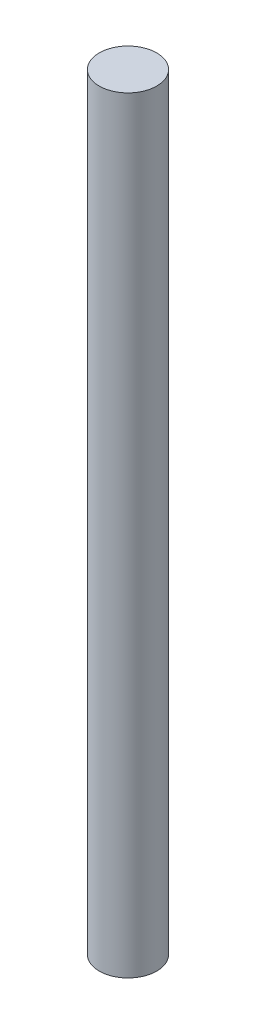
from build123d import *

# Parameters (mm, degrees)
SKETCH_1_R      = 0.75
EXTRUDE_1_DEPTH = 20


with BuildPart() as part:
    # 草图1 → 凸台-拉伸1 (new body)
    with BuildSketch(Plane(origin=(0, 0, 0), x_dir=(1, 0, 0), z_dir=(0, 1, 0))):
        with Locations(Location((0, 0, 0), (0, 0, 270))):
            Circle(SKETCH_1_R)
    extrude(amount=EXTRUDE_1_DEPTH)


solid = part.part
